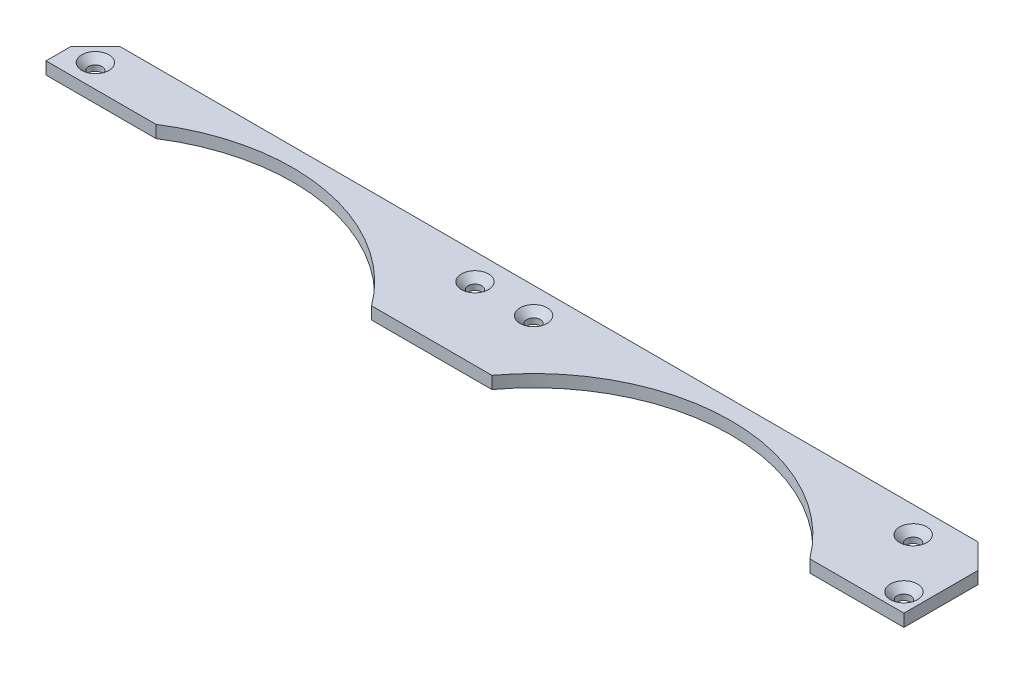
from build123d import *

# Parameters (mm, degrees)
SKETCH_1_W               = 147
SKETCH_1_H               = 37
EXTRUDE_1_DEPTH          = 2
SKETCH_2_R               = 1
CUT_EXTRUDE_604_DEPTH    = 2
SKETCH_5_R               = 1
SKETCH_5_R_2             = 32
FANS_DEPTH               = 10
CHAMFER_1_SIZE           = 4
SKETCH_6_W               = 44.721110511
SKETCH_6_H               = 34.816534288
SKETCH_6_W_2             = 53.357784661
SKETCH_6_W_3             = 25.346191928
SKETCH_6_H_2             = 23.882814665
CUT_EXTRUDE_1_DEPTH      = 10
HOLE_WIZARD_1_AT_2_COUNT = 2
HOLE_WIZARD_1_AT_2_PITCH = 61.5
HOLE_WIZARD_1_AT_3_COUNT = 2
HOLE_WIZARD_1_AT_3_PITCH = 71
HOLE_WIZARD_1_AT_4_COUNT = 2
HOLE_WIZARD_1_AT_4_PITCH = 132.5
HOLE_WIZARD_1_AT_5_COUNT = 2
HOLE_WIZARD_1_AT_5_PITCH = 140.023658715


with BuildPart() as part:
    # 草图1 → 凸台-拉伸1 (new body)
    with BuildSketch(Plane(origin=(0, 0, 0), x_dir=(1, 0, 0), z_dir=(0, 1, 0))):
        with Locations((73.5, -18.5)):
            Rectangle(SKETCH_1_W, SKETCH_1_H)
    extrude(amount=EXTRUDE_1_DEPTH)

    # 草图2 → Cut-Extrude 604 (cut)
    with BuildSketch(Plane(origin=(0, 2, 0), x_dir=(1, 0, 0), z_dir=(0, 1, 0))):
        with Locations(Location((144, -13, 0), (0, 0, 270))):
            Circle(SKETCH_2_R)
    extrude(amount=-CUT_EXTRUDE_604_DEPTH, mode=Mode.SUBTRACT)

    # 草图5 → Fans (cut)
    with BuildSketch(Plane(origin=(0, 2, 0), x_dir=(1, 0, 0), z_dir=(0, 1, 0))):
        with Locations(Location((75.25, -4.25, 0), (0, 0, 270))):
            Circle(SKETCH_5_R)
        with Locations(Location((136.75, -4.25, 0), (0, 0, 270))):
            Circle(SKETCH_5_R)
        with Locations((106, -35)):
            Circle(SKETCH_5_R_2)
        with Locations(Location((4.25, -4.25, 0), (0, 0, 270))):
            Circle(SKETCH_5_R)
        with Locations(Location((65.75, -4.25, 0), (0, 0, 270))):
            Circle(SKETCH_5_R)
        with Locations((35, -35)):
            Circle(SKETCH_5_R_2)
    extrude(amount=-FANS_DEPTH, mode=Mode.SUBTRACT)

    # 倒角1
    chamfer_1_edges = [part.edges().sort_by_distance(p)[0] for p in [
        (0, 1, 0),
        (147, 1, 0),
    ]]
    chamfer(chamfer_1_edges, length=CHAMFER_1_SIZE)

    # 草图6 → 切除-拉伸1 (cut)
    with BuildSketch(Plane(origin=(0, 0, 0), x_dir=(-1, 0, 0), z_dir=(0, -1, 0))):
        with Locations((-9.242414788, -25.408267144)):
            Rectangle(SKETCH_6_W, SKETCH_6_H)
        with Locations((-130.712137278, -33.408267144)):
            Rectangle(SKETCH_6_W_2, SKETCH_6_H)
        with Locations((-72.793206756, -27.941407333)):
            Rectangle(SKETCH_6_W_3, SKETCH_6_H_2)
    extrude(amount=-CUT_EXTRUDE_1_DEPTH, mode=Mode.SUBTRACT)

    # 草图8 → 打孔尺寸(%根据)内六角花形沉头螺钉的类型1 (revolve, cut)
    with BuildSketch(Plane(origin=(4.25, 2, 4.25), x_dir=(0, 0, 1), z_dir=(1, 0, 0))):
        Polygon((0, 0), (0, 2), (1.1, 2), (1.1, 1.1), (2.2, 0), align=None)
    hole_wizard_1 = revolve(axis=Axis((4.25, 8.35, 4.25), (0, -1, 0)), mode=Mode.SUBTRACT)

    # 打孔尺寸(%根据)内六角花形沉头螺钉的类型1 at 2: 打孔尺寸(%根据)内六角花形沉头螺钉的类型1 ×2
    with Locations(*[(i * HOLE_WIZARD_1_AT_2_PITCH, 0, 0) for i in range(1, HOLE_WIZARD_1_AT_2_COUNT)]):
        add(hole_wizard_1, mode=Mode.SUBTRACT)

    # 打孔尺寸(%根据)内六角花形沉头螺钉的类型1 at 3: 打孔尺寸(%根据)内六角花形沉头螺钉的类型1 ×2
    with Locations(*[(i * HOLE_WIZARD_1_AT_3_PITCH, 0, 0) for i in range(1, HOLE_WIZARD_1_AT_3_COUNT)]):
        add(hole_wizard_1, mode=Mode.SUBTRACT)

    # 打孔尺寸(%根据)内六角花形沉头螺钉的类型1 at 4: 打孔尺寸(%根据)内六角花形沉头螺钉的类型1 ×2
    with Locations(*[(i * HOLE_WIZARD_1_AT_4_PITCH, 0, 0) for i in range(1, HOLE_WIZARD_1_AT_4_COUNT)]):
        add(hole_wizard_1, mode=Mode.SUBTRACT)

    # 打孔尺寸(%根据)内六角花形沉头螺钉的类型1 at 5: 打孔尺寸(%根据)内六角花形沉头螺钉的类型1 ×2
    with Locations(*[Vector(0.9980456251626064, 0, 0.062489439858123795) * (i * HOLE_WIZARD_1_AT_5_PITCH) for i in range(1, HOLE_WIZARD_1_AT_5_COUNT)]):
        add(hole_wizard_1, mode=Mode.SUBTRACT)


solid = part.part
